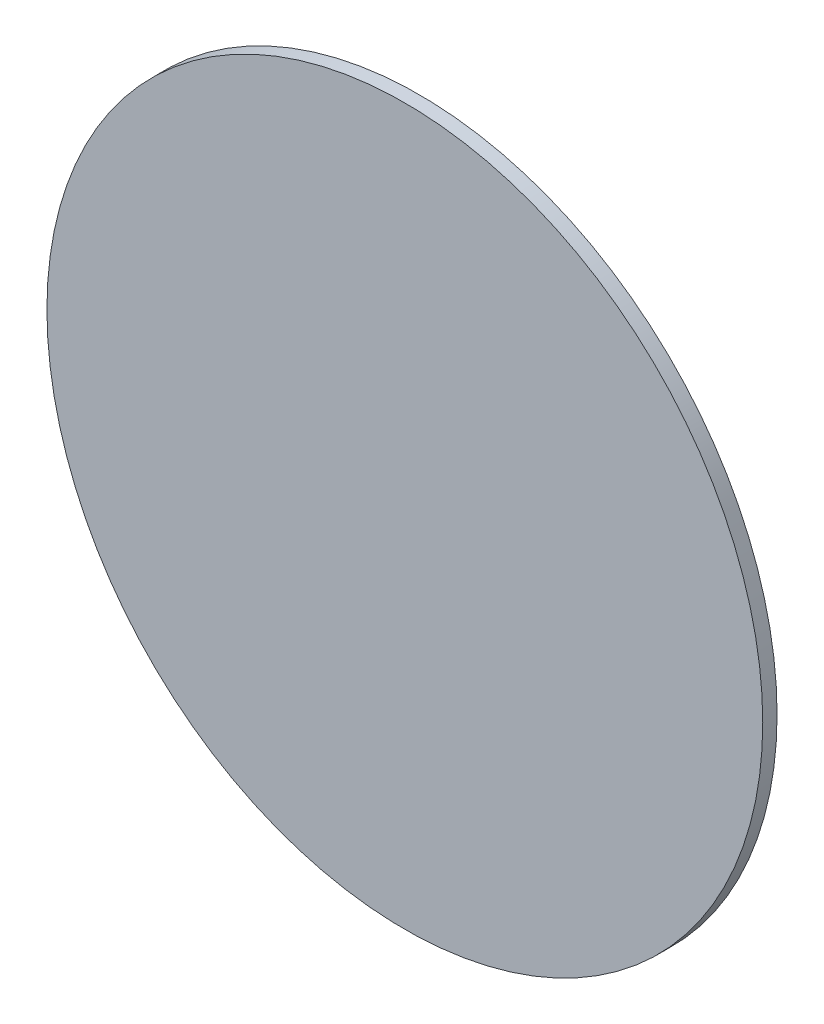
from build123d import *

# Parameters (mm, degrees)
SKETCH1_R           = 125
BOSS_EXTRUDE1_DEPTH = 5


with BuildPart() as part:
    # Sketch1 → Boss-Extrude1 (new body)
    with BuildSketch(Plane.XY):
        Circle(SKETCH1_R)
    extrude(amount=BOSS_EXTRUDE1_DEPTH)


solid = part.part
